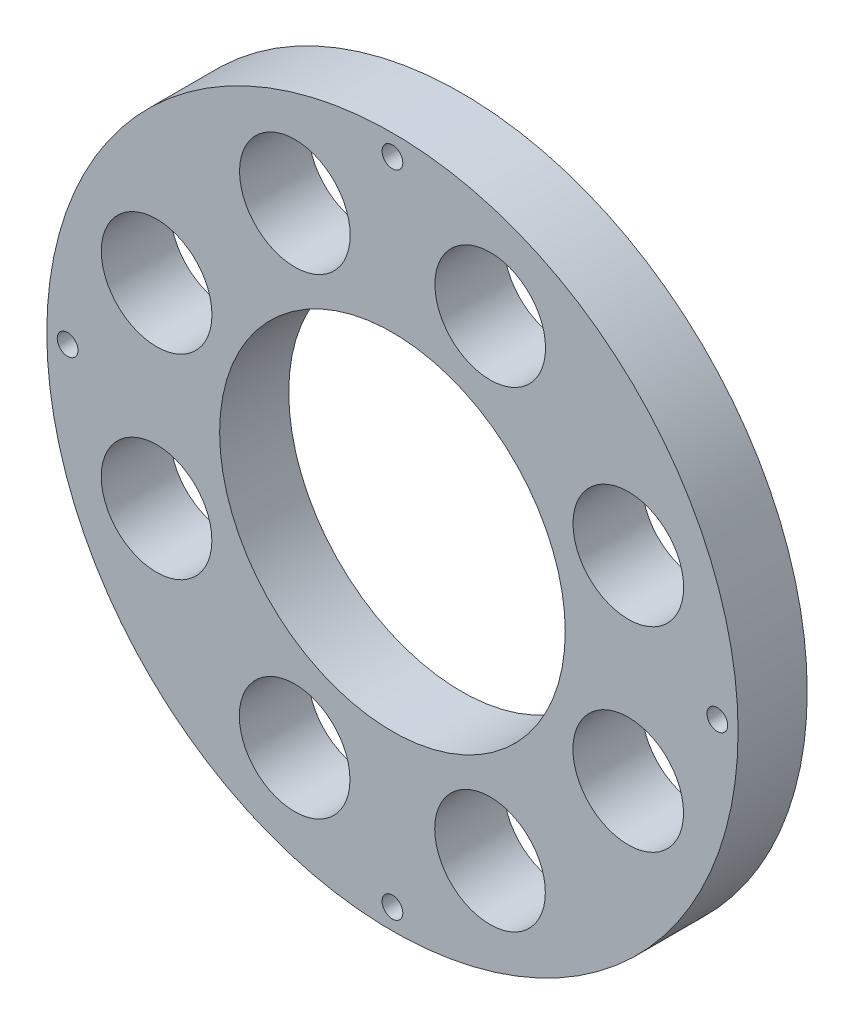
from build123d import *

# Parameters (mm, degrees)
SKETCH1_R           = 50
SKETCH1_R_2         = 25
BOSS_EXTRUDE1_DEPTH = 10
SKETCH3_R           = 8
CUT_EXTRUDE1_DEPTH  = 20
SKETCH4_R           = 1.5
CUT_EXTRUDE2_DEPTH  = 30


with BuildPart() as part:
    # Sketch1 → Boss-Extrude1 (new body)
    with BuildSketch(Plane.XY):
        Circle(SKETCH1_R)
        Circle(SKETCH1_R_2, mode=Mode.SUBTRACT)
    extrude(amount=BOSS_EXTRUDE1_DEPTH)

    # Sketch3 → Cut-Extrude1 (cut)
    with BuildSketch(Plane(origin=(0, 0, 0), x_dir=(-1, 0, 0), z_dir=(0, 0, -1))):
        with Locations((-14.146357726, 34.109474384)):
            Circle(SKETCH3_R)
        with Locations((14.116055163, 34.122026117)):
            Circle(SKETCH3_R)
        with Locations((34.109474384, 14.146357726)):
            Circle(SKETCH3_R)
        with Locations((34.122026117, -14.116055163)):
            Circle(SKETCH3_R)
        with Locations((14.146357726, -34.109474384)):
            Circle(SKETCH3_R)
        with Locations((-14.116055163, -34.122026117)):
            Circle(SKETCH3_R)
        with Locations((-34.109474384, -14.146357726)):
            Circle(SKETCH3_R)
        with Locations((-34.122026117, 14.116055163)):
            Circle(SKETCH3_R)
    extrude(amount=-CUT_EXTRUDE1_DEPTH, mode=Mode.SUBTRACT)

    # Sketch4 → Cut-Extrude2 (cut)
    with BuildSketch(Plane(origin=(0, 0, 0), x_dir=(-1, 0, 0), z_dir=(0, 0, -1))):
        with Locations((0, 46.99)):
            Circle(SKETCH4_R)
        with Locations((46.99, 0)):
            Circle(SKETCH4_R)
        with Locations((0, -46.99)):
            Circle(SKETCH4_R)
        with Locations((-46.99, 0)):
            Circle(SKETCH4_R)
    extrude(amount=-CUT_EXTRUDE2_DEPTH, mode=Mode.SUBTRACT)


solid = part.part
